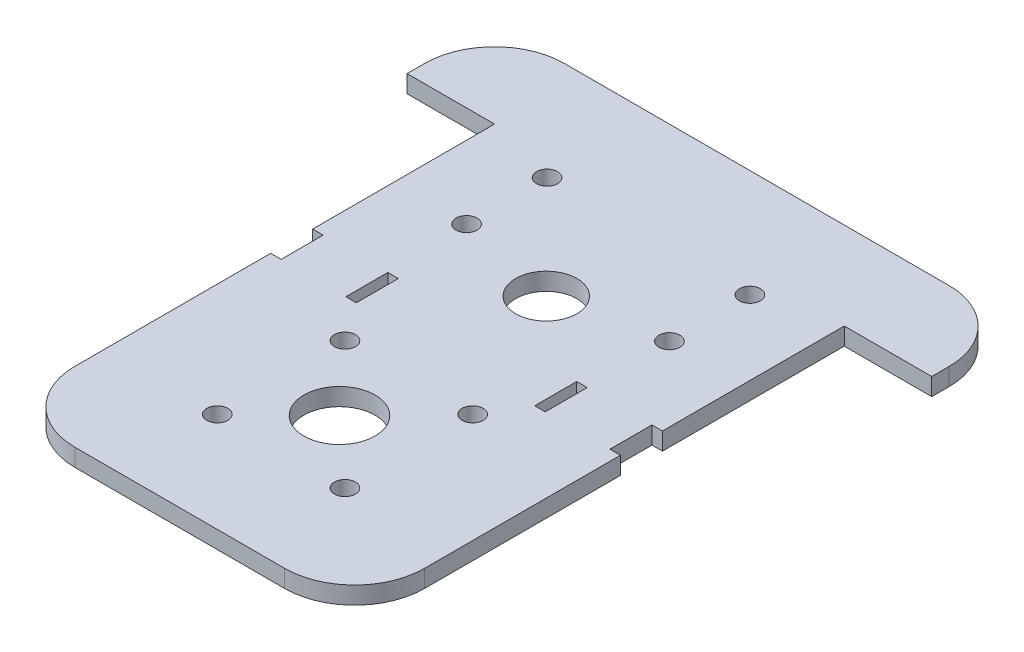
from build123d import *

# Parameters (mm, degrees)
SKETCH1_R           = 8.743447226
SKETCH1_R_2         = 3
SKETCH1_R_3         = 10.172294787
SKETCH1_W           = 3
SKETCH1_H           = 12
BOSS_EXTRUDE1_DEPTH = 5
FILLET3_R           = 20
FILLET4_R           = 20
FILLET5_R           = 20


with BuildPart() as part:
    # Sketch1 → Boss-Extrude1 (new body)
    with BuildSketch(Plane(origin=(0, 0, 0), x_dir=(1, 0, 0), z_dir=(0, 1, 0))):
        Polygon((25, 35), (125, 35), (125, 111), (122, 111), (122, 123), (125, 123), (125, 175), (150, 175), (150, 200), (0, 200), (0, 175), (25, 175), (25, 123), (28, 123), (28, 111), (25, 111), align=None)
        with Locations(Location((75, 139.799864951, 0), (0, 0, 270))):
            Circle(SKETCH1_R, mode=Mode.SUBTRACT)
        with Locations(Location((93.745998674, 100, 0), (0, 0, 270))):
            Circle(SKETCH1_R_2, mode=Mode.SUBTRACT)
        with Locations(Location((93.745998674, 63.5, 0), (0, 0, 270))):
            Circle(SKETCH1_R_2, mode=Mode.SUBTRACT)
        with Locations(Location((75, 80.674864151, 0), (0, 0, 270))):
            Circle(SKETCH1_R_3, mode=Mode.SUBTRACT)
        with Locations(Location((57.245998674, 63.5, 0), (0, 0, 270))):
            Circle(SKETCH1_R_2, mode=Mode.SUBTRACT)
        with Locations(Location((57.245998674, 100, 0), (0, 0, 270))):
            Circle(SKETCH1_R_2, mode=Mode.SUBTRACT)
        with Locations((48, 117)):
            Rectangle(SKETCH1_W, SKETCH1_H, mode=Mode.SUBTRACT)
        with Locations(Location((45.771721368, 146.237160755, 0), (0, 0, 270))):
            Circle(SKETCH1_R_2, mode=Mode.SUBTRACT)
        with Locations(Location((45.771721368, 169.237160755, 0), (0, 0, 270))):
            Circle(SKETCH1_R_2, mode=Mode.SUBTRACT)
        with Locations((102, 117)):
            Rectangle(SKETCH1_W, SKETCH1_H, mode=Mode.SUBTRACT)
        with Locations(Location((103.771721368, 146.237160755, 0), (0, 0, 270))):
            Circle(SKETCH1_R_2, mode=Mode.SUBTRACT)
        with Locations(Location((103.771721368, 169.237160755, 0), (0, 0, 270))):
            Circle(SKETCH1_R_2, mode=Mode.SUBTRACT)
    extrude(amount=BOSS_EXTRUDE1_DEPTH)

    # Fillet3
    fillet3_edges = [part.edges().sort_by_distance(p)[0] for p in [
        (0, 2.5, -200),
    ]]
    fillet(fillet3_edges, radius=FILLET3_R)

    # Fillet4
    fillet4_edges = [part.edges().sort_by_distance(p)[0] for p in [
        (150, 2.5, -200),
    ]]
    fillet(fillet4_edges, radius=FILLET4_R)

    # Fillet5
    fillet5_edges = [part.edges().sort_by_distance(p)[0] for p in [
        (125, 2.5, -35),
        (25, 2.5, -35),
    ]]
    fillet(fillet5_edges, radius=FILLET5_R)


solid = part.part
